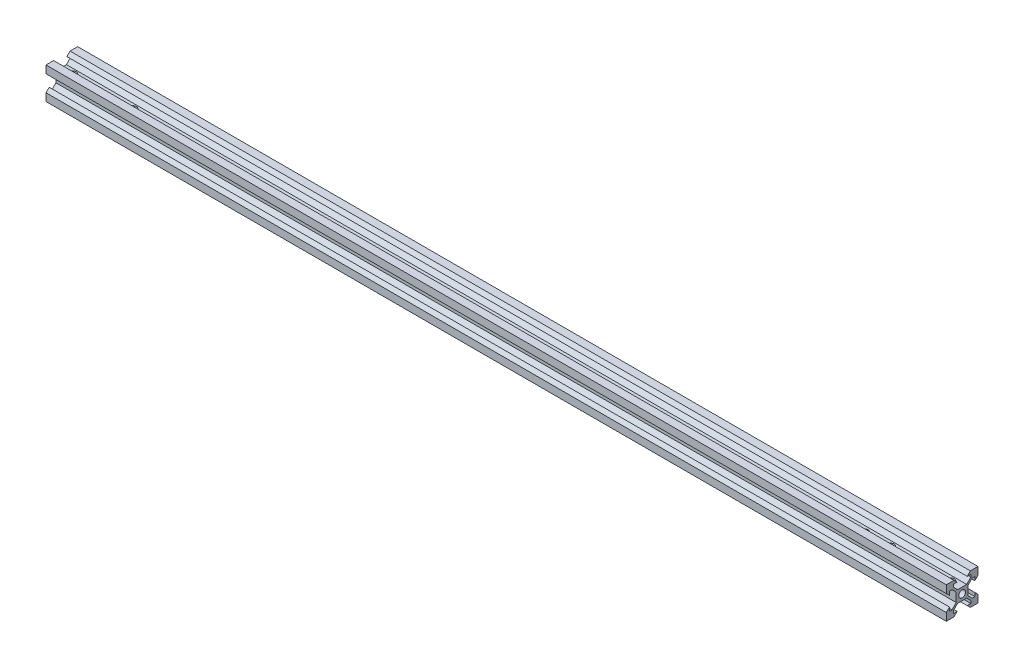
from build123d import *

# Parameters (mm, degrees)
SKETCH11_R                             = 2.15
F_20X20_ENDER_CONFIGURED_20X20_1_DEPTH = 568
M5X0_8_TAPPED_HOLE1_D                  = 4.2
M4X0_7_TAPPED_HOLE1_D                  = 3.3


with BuildPart() as part:
    # Sketch11 → 20x20-ender - configured 20X20(1) (new body)
    with BuildSketch(Plane.YZ.offset(-284)):
        Polygon((-10, 10), (-5.175, 10), (-3.175, 8), (-5.5, 8), (-5.5, 6.383883477), (-2.866116524, 3.75), (2.866116524, 3.75), (5.5, 6.383883476), (5.5, 8), (3.175, 8), (5.175, 10), (10, 10), (10, 5.175), (8, 3.175), (8, 5.5), (6.383883476, 5.5), (3.75, 2.866116524), (3.75, -2.866116524), (6.383883476, -5.5), (8, -5.5), (8, -3.175), (10, -5.175), (10, -10), (5.175, -10), (3.175, -8), (5.5, -8), (5.5, -6.383883476), (2.866116524, -3.75), (-2.866116524, -3.75), (-5.5, -6.383883476), (-5.5, -8), (-3.175, -8), (-5.175, -10), (-10, -10), (-10, -5.175), (-8, -3.175), (-8, -5.5), (-6.383883476, -5.5), (-3.75, -2.866116524), (-3.75, 2.866116524), (-6.383883476, 5.5), (-8, 5.5), (-8, 3.175), (-10, 5.175), align=None)
        Circle(SKETCH11_R, mode=Mode.SUBTRACT)
    extrude(amount=F_20X20_ENDER_CONFIGURED_20X20_1_DEPTH)

    # M5x0.8 Tapped Hole1 (through all)
    with Locations(Plane(origin=(0, 3.75, 0), x_dir=(1, 0, 0), z_dir=(0, 1, 0))):
        with Locations((-239, 0), (277, 0), (239, 0), (-277, 0)):
            Hole(M5X0_8_TAPPED_HOLE1_D / 2)

    # M4x0.7 Tapped Hole1 (through all)
    with Locations(Plane(origin=(0, 3.75, 0), x_dir=(1, 0, 0), z_dir=(0, 1, 0))):
        with Locations((223, 0)):
            Hole(M4X0_7_TAPPED_HOLE1_D / 2)


solid = part.part
